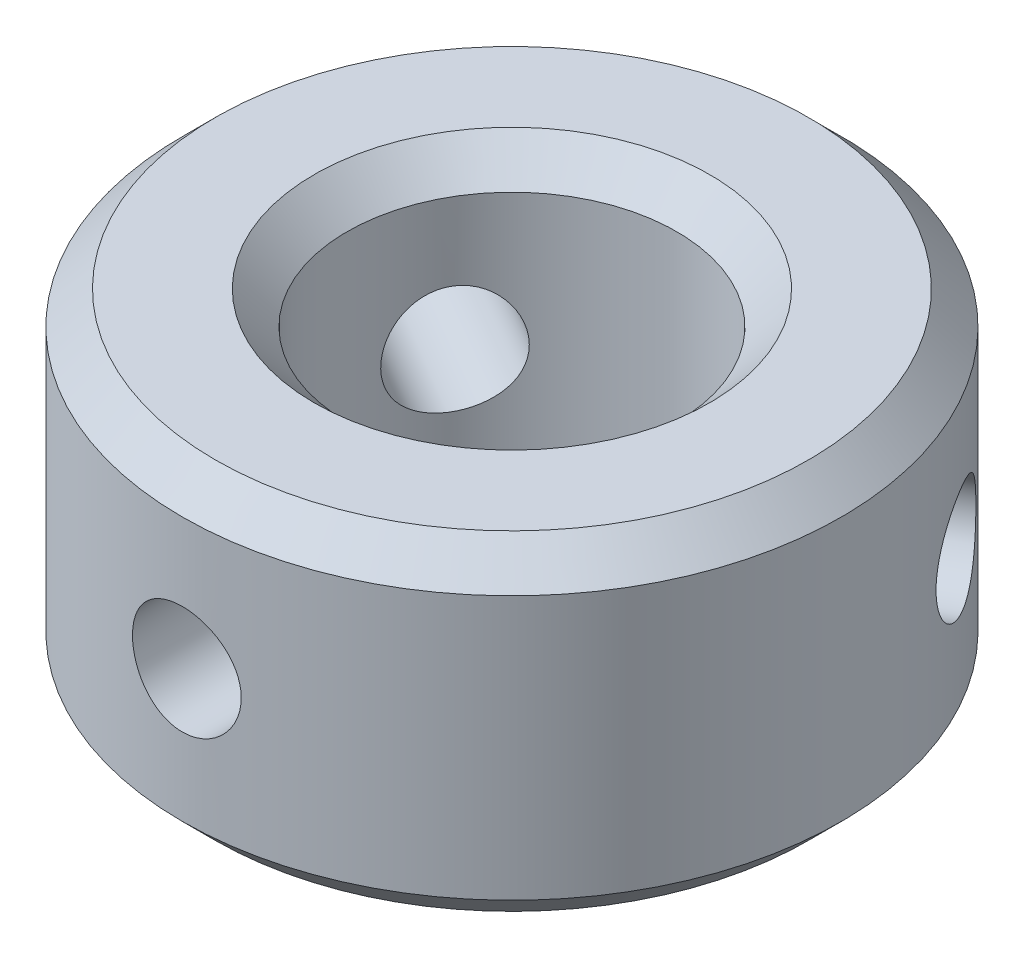
from build123d import *

# Parameters (mm, degrees)
SKETCH1_R           = 10
SKETCH1_R_2         = 5
BOSS_EXTRUDE1_DEPTH = 10
CHAMFER1_SIZE       = 1
SKETCH3_W           = 1.65
SKETCH3_H           = 10
CIRPATTERN1_COUNT   = 3


with BuildPart() as part:
    # Sketch1 → Boss-Extrude1 (new body)
    with BuildSketch(Plane(origin=(0, 0, 0), x_dir=(1, 0, 0), z_dir=(0, 1, 0))):
        with Locations(Location((0, 0, 0), (0, 0, 270))):
            Circle(SKETCH1_R)
        with Locations(Location((0, 0, 0), (0, 0, 270))):
            Circle(SKETCH1_R_2, mode=Mode.SUBTRACT)
    extrude(amount=-BOSS_EXTRUDE1_DEPTH)

    # Chamfer1
    chamfer1_edges = [part.edges().sort_by_distance(p)[0] for p in [
        (0, 0, -10),
        (0, -10, -10),
        (0, -10, -5),
        (0, 0, -5),
    ]]
    chamfer(chamfer1_edges, length=CHAMFER1_SIZE)

    # Sketch3 → M4 Tapped Hole1 (revolve, cut)
    with BuildSketch(Plane(origin=(0, -5, 0), x_dir=(0, 1, 0), z_dir=(1, 0, 0))):
        with Locations((0.825, 5)):
            Rectangle(SKETCH3_W, SKETCH3_H)
    m4_tapped_hole1 = revolve(axis=Axis((0, -5, -6.35), (0, 0, 1)), mode=Mode.SUBTRACT)

    # CirPattern1: M4 Tapped Hole1 ×3 about axis
    cirpattern1_axis = Axis((0, -1, 0), (0, 1, 0))
    for i in range(1, CIRPATTERN1_COUNT):
        add(m4_tapped_hole1.rotate(cirpattern1_axis, i * 360 / CIRPATTERN1_COUNT), mode=Mode.SUBTRACT)


solid = part.part
